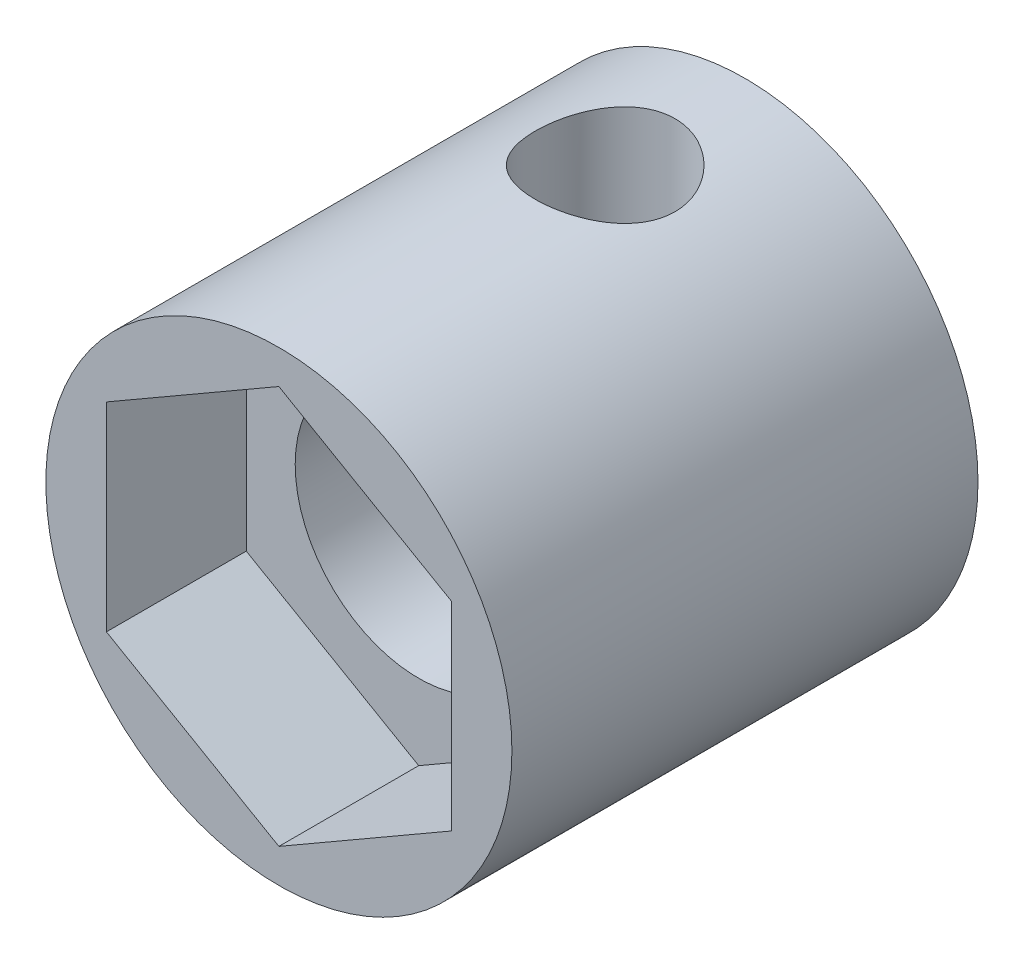
from build123d import *

# Parameters (mm, degrees)
ESQUISSE1_R                  = 5
BOSS_EXTRU_1_DEPTH           = 10
ENL_V_MAT_EXTRU_1_DEPTH      = 3
ESQUISSE3_R                  = 2.65
ENL_V_MAT_EXTRU_2_DEPTH      = 6
ENL_V_MAT_EXTRU_3_DEPTH      = 13.247448714
ENL_V_MAT_EXTRU_3_DEPTH_BACK = 13.247448714
ESQUISSE4_R                  = 1.5
ESQUISSE5_R                  = 2.65
ENL_V_MAT_EXTRU_4_DEPTH      = 10.273618668


with BuildPart() as part:
    # Esquisse1 → Boss.-Extru.1 (new body)
    with BuildSketch(Plane.XY):
        Circle(ESQUISSE1_R)
    extrude(amount=BOSS_EXTRU_1_DEPTH)

    # Esquisse2 → Enlèv. mat.-Extru.1 (cut)
    with BuildSketch(Plane.XY.offset(10)):
        Polygon((3.7, -2.136195996), (3.7, 2.136195996), (0, 4.272391992), (-3.7, 2.136195996), (-3.7, -2.136195996), (0, -4.272391992), align=None)
    extrude(amount=-ENL_V_MAT_EXTRU_1_DEPTH, mode=Mode.SUBTRACT)

    # Esquisse3 → Enlèv. mat.-Extru.2 (cut)
    with BuildSketch(Plane(origin=(0, 0, 0), x_dir=(-1, 0, 0), z_dir=(0, 0, -1))):
        Circle(ESQUISSE3_R)
    extrude(amount=-ENL_V_MAT_EXTRU_2_DEPTH, mode=Mode.SUBTRACT)

    # Esquisse4 → Enlèv. mat.-Extru.3 (cut, two sides: drawn at the far end of the back side and taken through both)
    with BuildSketch(Plane(origin=(0, 0, 0), x_dir=(1, 0, 0), z_dir=(0, 1, 0)).offset(-ENL_V_MAT_EXTRU_3_DEPTH_BACK)):
        with Locations(Location((0, -3, 0), (0, 0, 270))):
            Circle(ESQUISSE4_R)
    extrude(amount=ENL_V_MAT_EXTRU_3_DEPTH + ENL_V_MAT_EXTRU_3_DEPTH_BACK, mode=Mode.SUBTRACT)

    # Esquisse5 → Enlèv. mat.-Extru.4 (cut, through all)
    with BuildSketch(Plane(origin=(0, 0, 6), x_dir=(-1, 0, 0), z_dir=(0, 0, -1))):
        Circle(ESQUISSE5_R)
    extrude(amount=-ENL_V_MAT_EXTRU_4_DEPTH, mode=Mode.SUBTRACT)


solid = part.part
